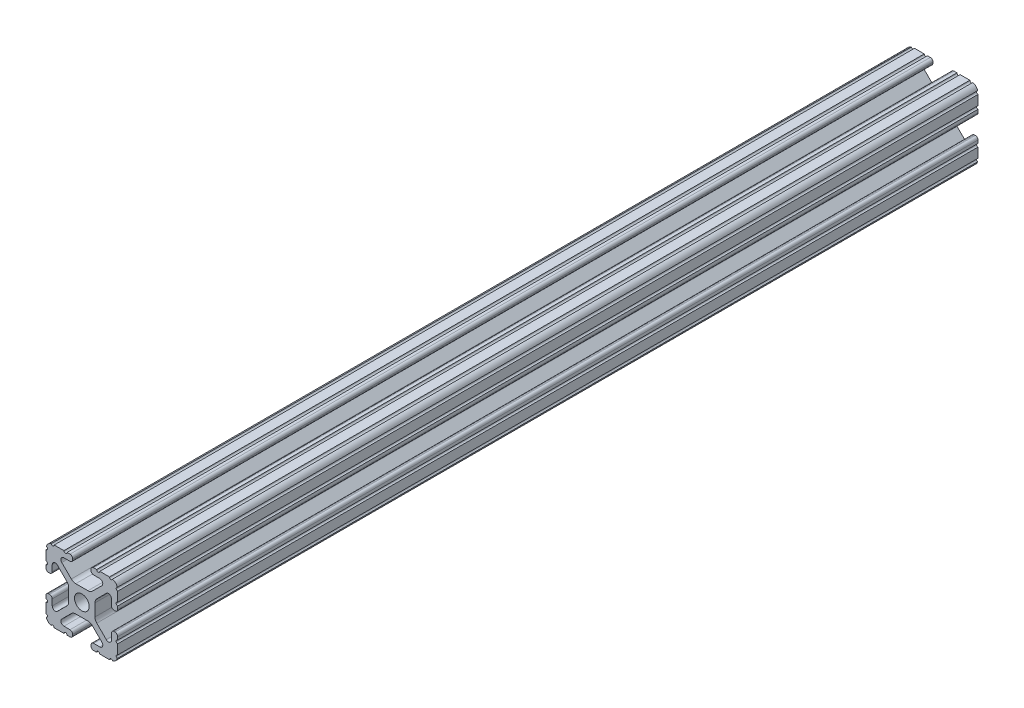
from build123d import *

# Parameters (mm, degrees)
BOSS_EXTRUDE1_DEPTH     = 228.6
CUT_EXTRUDE1_DEPTH      = 230.304470083
CUT_EXTRUDE1_DEPTH_BACK = 230.304470083
SKETCH5_R               = 0.55245
SKETCH6_W               = 44.500349861
SKETCH6_H               = 38.264632046
CUT_EXTRUDE2_DEPTH      = 152.4


with BuildPart() as part:
    # Sketch4 → Boss-Extrude1 (new, symmetric)
    with BuildSketch(Plane.XY):
        with BuildLine():
            Line((4.190365, -12.7), (10.11729625, -12.7))
            ThreePointArc((10.11729625, -12.7), (11.943543585, -11.943543585), (12.7, -10.11729625))
            Line((12.7, -10.11729625), (12.7, -4.190365))
            ThreePointArc((12.7, -4.190365), (12.42492494, -3.52627506), (11.760835, -3.2512))
            Line((11.760835, -3.2512), (11.429365, -3.2512))
            ThreePointArc((11.429365, -3.2512), (10.76527506, -3.52627506), (10.4902, -4.190365))
            Line((10.4902, -4.190365), (10.4902, -6.348478019))
            ThreePointArc((10.4902, -6.348478019), (9.830707141, -7.335478831), (8.666460301, -7.103895736))
            Line((8.666460301, -7.103895736), (5.299899128, -3.737334563))
            ThreePointArc((5.299899128, -3.737334563), (4.817571085, -3.015479634), (4.6482, -2.16399369))
            Line((4.6482, -2.16399369), (4.6482, 0))
            Line((4.6482, 0), (2.6035, 0))
            ThreePointArc((2.6035, 0), (1.840952505, -1.840952505), (0, -2.6035))
            Line((0, -2.6035), (0, -4.6482))
            Line((0, -4.6482), (2.16399369, -4.6482))
            ThreePointArc((2.16399369, -4.6482), (3.015479634, -4.817571085), (3.737334563, -5.299899128))
            Line((3.737334563, -5.299899128), (7.103895736, -8.666460301))
            ThreePointArc((7.103895736, -8.666460301), (7.335478831, -9.830707141), (6.348478019, -10.4902))
            Line((6.348478019, -10.4902), (4.190365, -10.4902))
            ThreePointArc((4.190365, -10.4902), (3.52627506, -10.76527506), (3.2512, -11.429365))
            Line((3.2512, -11.429365), (3.2512, -11.760835))
            ThreePointArc((3.2512, -11.760835), (3.52627506, -12.42492494), (4.190365, -12.7))
        make_face()
    extrude(amount=BOSS_EXTRUDE1_DEPTH, both=True)

    # Sketch5 → Cut-Extrude1 (cut, two sides: drawn at the far end of the back side and taken through both)
    with BuildSketch(Plane.XY.offset(-CUT_EXTRUDE1_DEPTH_BACK)):
        with Locations((10.356153152, -12.7)):
            Circle(SKETCH5_R)
        with Locations((5.796028019, -12.7)):
            Circle(SKETCH5_R)
        with Locations((12.7, -10.356153152)):
            Circle(SKETCH5_R)
        with Locations((12.7, -5.796028019)):
            Circle(SKETCH5_R)
    extrude(amount=CUT_EXTRUDE1_DEPTH + CUT_EXTRUDE1_DEPTH_BACK, mode=Mode.SUBTRACT)

    # Mirror1: part across plane


with BuildPart() as part_1:
    add(part.part)
    add(part.part.mirror(Plane(origin=(0, 0, 0), x_dir=(0, 0, 1), z_dir=(1, 0, 0))))

    # Mirror2: part across plane


with BuildPart() as part_2:
    add(part_1.part)
    add(part_1.part.mirror(Plane.ZX))

    # Sketch6 → Cut-Extrude2 (cut)
    with BuildSketch(Plane(origin=(0, 0, -228.6), x_dir=(-1, 0, 0), z_dir=(0, 0, -1))):
        with Locations((3.231443254, 0.521897793)):
            Rectangle(SKETCH6_W, SKETCH6_H)
    extrude(amount=-CUT_EXTRUDE2_DEPTH, mode=Mode.SUBTRACT)


solid = part_2.part
